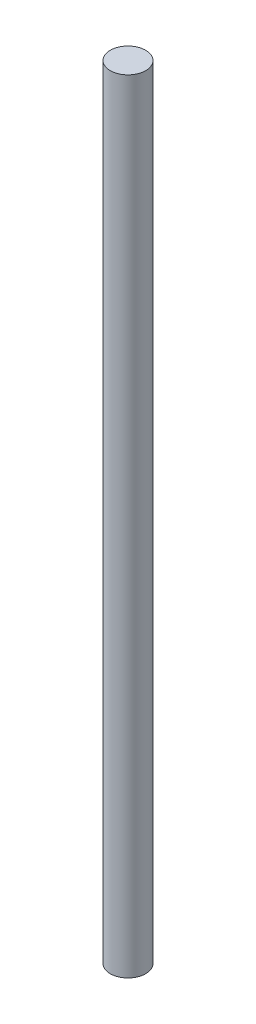
from build123d import *

# Parameters (mm, degrees)
SKETCH1_R           = 1.5875
BOSS_EXTRUDE1_DEPTH = 70.186903159


with BuildPart() as part:
    # Sketch1 → Boss-Extrude1 (new body)
    with BuildSketch(Plane(origin=(0, 0, 0), x_dir=(-1, 0, 0), z_dir=(0, 1, 0))):
        with Locations(Location((0, 0, 0), (0, 0, 90))):
            Circle(SKETCH1_R)
    extrude(amount=BOSS_EXTRUDE1_DEPTH)


solid = part.part
